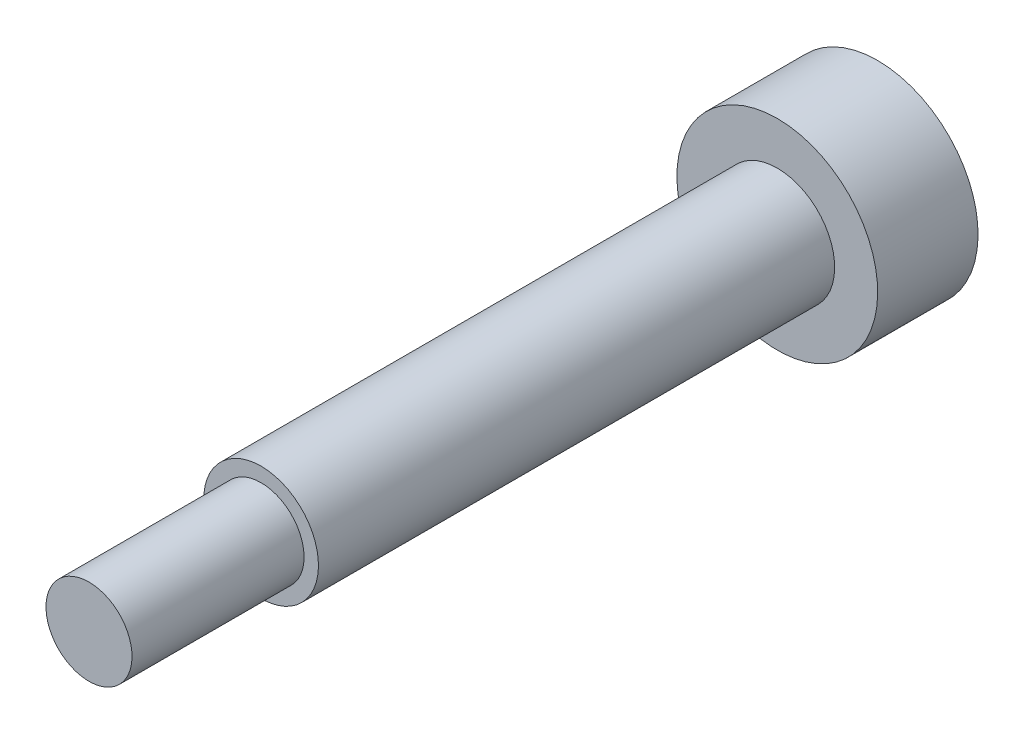
from build123d import *


with BuildPart() as part:
    # 草图1 → 旋转2 (revolve)
    with BuildSketch(Plane(origin=(0, 0, 0), x_dir=(0, 0, -1), z_dir=(1, 0, 0))):
        Polygon((0, 0), (0, 1.5), (6, 1.5), (6, 2), (24, 2), (24, 3.5), (27.5, 3.5), (27.5, 0), align=None)
    revolve(axis=Axis((0, 0, -27.5), (0, 0, 1)))


solid = part.part
